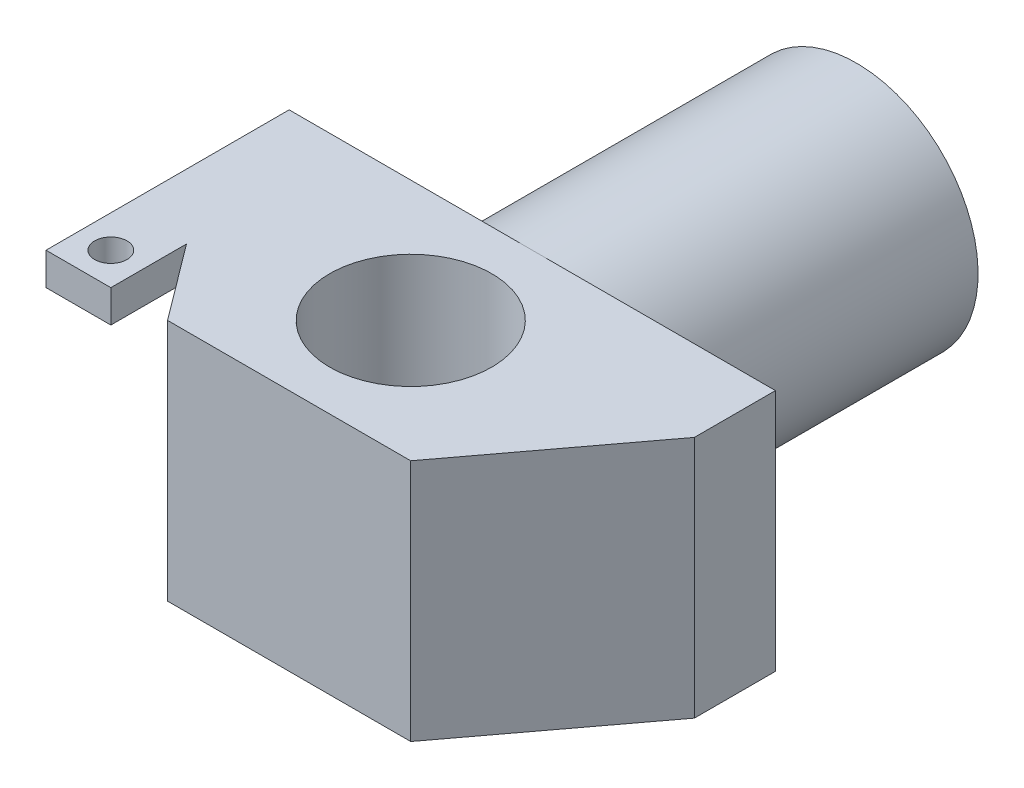
from build123d import *

# Parameters (mm, degrees)
SKETCH1_R           = 2.5
BOSS_EXTRUDE1_DEPTH = 7.5
SKETCH2_R           = 3.75
BOSS_EXTRUDE2_DEPTH = 10
SKETCH3_W           = 2
SKETCH3_H           = 1
BOSS_EXTRUDE3_DEPTH = 7.5
SKETCH4_R           = 0.5
CUT_EXTRUDE1_DEPTH  = 1


with BuildPart() as part:
    # Sketch1 → Boss-Extrude1 (new body)
    with BuildSketch(Plane(origin=(0, 0, 0), x_dir=(1, 0, 0), z_dir=(0, 1, 0))):
        Polygon((-43.152827627, -30.672089533), (-35.652827627, -30.672089533), (-31.902827627, -25.672089533), (-31.902827627, -23.172089533), (-46.902827627, -23.172089533), (-46.902827627, -25.672089533), align=None)
        with Locations(Location((-39.402827627, -26.922089533, 0), (0, 0, 270))):
            Circle(SKETCH1_R, mode=Mode.SUBTRACT)
    extrude(amount=BOSS_EXTRUDE1_DEPTH)

    # Sketch2 → Boss-Extrude2 (add)
    with BuildSketch(Plane(origin=(0, 0, 23.172089533), x_dir=(-1, 0, 0), z_dir=(0, 0, -1))):
        with Locations(Location((39.402827627, 3.75, 0), (0, 0, 270))):
            Circle(SKETCH2_R)
    extrude(amount=BOSS_EXTRUDE2_DEPTH)

    # Sketch3 → Boss-Extrude3 (add)
    with BuildSketch(Plane(origin=(0, 0, 23.172089533), x_dir=(-1, 0, 0), z_dir=(0, 0, -1))):
        with Locations((45.902827627, 7)):
            Rectangle(SKETCH3_W, SKETCH3_H)
    extrude(amount=-BOSS_EXTRUDE3_DEPTH)

    # Sketch4 → Cut-Extrude1 (cut)
    with BuildSketch(Plane(origin=(0, 7.5, 0), x_dir=(1, 0, 0), z_dir=(0, 1, 0))):
        with Locations(Location((-45.902827627, -29.672089533, 0), (0, 0, 270))):
            Circle(SKETCH4_R)
    extrude(amount=-CUT_EXTRUDE1_DEPTH, mode=Mode.SUBTRACT)


solid = part.part
